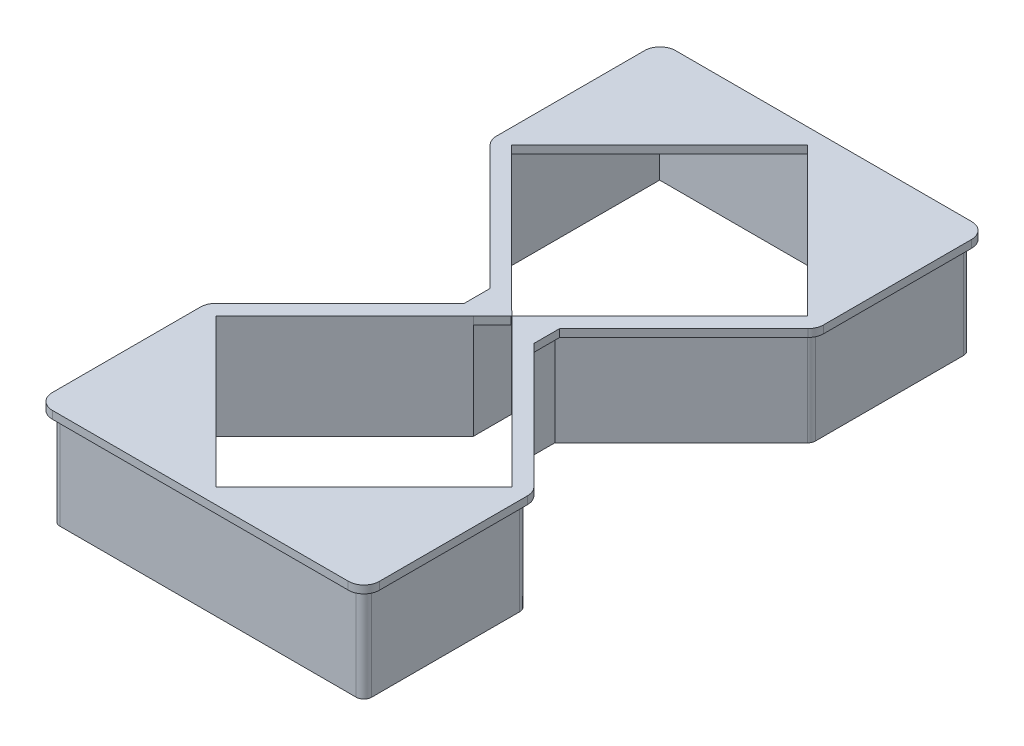
from build123d import *

# Parameters (mm, degrees)
EXTRUDE_2_DEPTH      = 1.2
EXTRUDE_4_DEPTH      = 15
CUT_EXTRUDE_13_REACH = 109.14
CUT_EXTRUDE_15_REACH = 109.14
CUT_EXTRUDE_16_REACH = 109.14
CUT_EXTRUDE_17_REACH = 73.673


with BuildPart() as part:
    # 草图1 → 凸台-拉伸2 (new body)
    with BuildSketch(Plane(origin=(0, 0, 0), x_dir=(1, 0, 0), z_dir=(0, 1, 0))):
        with BuildLine():
            Line((-2.399264051, 68.999900529), (-2.399264051, 91.999900529))
            ThreePointArc((-2.399264051, 91.999900529), (-1.696320326, 93.696956804), (0.000735949, 94.399900529))
            Line((0.000735949, 94.399900529), (46.000735949, 94.399900529))
            ThreePointArc((46.000735949, 94.399900529), (47.697792224, 93.696956804), (48.400735949, 91.999900529))
            Line((48.400735949, 91.999900529), (48.400735949, 68.999900529))
            ThreePointArc((48.400735949, 68.999900529), (48.218046827, 68.081460292), (47.697792224, 67.302844254))
            Line((47.697792224, 67.302844254), (28.40092775, 48.00597978))
            Line((28.40092775, 48.00597978), (28.40092775, 43.99420488))
            Line((28.40092775, 43.99420488), (47.697792224, 24.697340406))
            ThreePointArc((47.697792224, 24.697340406), (48.218046827, 23.918724369), (48.400735949, 23.000284131))
            Line((48.400735949, 23.000284131), (48.400735949, 0.000284131))
            ThreePointArc((48.400735949, 0.000284131), (47.681245751, -1.713158837), (45.954163612, -2.399263955))
            Line((45.954163612, -2.399263955), (0.000735672, -2.399263955))
            ThreePointArc((0.000735672, -2.399263955), (-1.696376241, -1.696695528), (-2.399264051, 0.000284131))
            Line((-2.399264051, 0.000284131), (-2.399264051, 23.000284131))
            ThreePointArc((-2.399264051, 23.000284131), (-2.216574929, 23.918724369), (-1.696320326, 24.697340406))
            Line((-1.696320326, 24.697340406), (17.600544148, 43.99420488))
            Line((17.600544148, 43.99420488), (17.600544148, 48.00597978))
            Line((17.600544148, 48.00597978), (-1.696320326, 67.302844254))
            ThreePointArc((-1.696320326, 67.302844254), (-2.216574929, 68.081460292), (-2.399264051, 68.999900529))
        make_face()
    extrude(amount=EXTRUDE_2_DEPTH)

    # 草图3 → 凸台-拉伸4 (add)
    with BuildSketch(Plane.XZ):
        with BuildLine():
            Line((0, -93.138725211), (46, -93.138725211))
            ThreePointArc((46, -93.138725211), (46.848528137, -92.787253348), (47.2, -91.938725211))
            Line((47.2, -91.938725211), (47.2, -68.938725211))
            ThreePointArc((47.2, -68.938725211), (47.108655439, -68.479505092), (46.848528137, -68.090197073))
            Line((46.848528137, -68.090197073), (27.200191801, -48.441860737))
            Line((27.200191801, -48.441860737), (27.200191801, -43.496864474))
            Line((27.200191801, -43.496864474), (46.848528137, -23.848528137))
            ThreePointArc((46.848528137, -23.848528137), (47.108655439, -23.459220119), (47.2, -23))
            Line((47.2, -23), (47.2, 0))
            ThreePointArc((47.2, 0), (46.848528137, 0.848528137), (46, 1.2))
            Line((46, 1.2), (0, 1.2))
            ThreePointArc((0, 1.2), (-0.848528137, 0.848528137), (-1.2, 0))
            Line((-1.2, 0), (-1.2, -23))
            ThreePointArc((-1.2, -23), (-1.108655439, -23.459220119), (-0.848528137, -23.848528137))
            Line((-0.848528137, -23.848528137), (18.799808199, -43.496864474))
            Line((18.799808199, -43.496864474), (18.799808199, -48.441860737))
            Line((18.799808199, -48.441860737), (-0.848528137, -68.090197073))
            ThreePointArc((-0.848528137, -68.090197073), (-1.108655439, -68.479505092), (-1.2, -68.938725211))
            Line((-1.2, -68.938725211), (-1.2, -91.938725211))
            ThreePointArc((-1.2, -91.938725211), (-0.848528137, -92.787253348), (0, -93.138725211))
        make_face()
        Polygon((0, -23), (19.999808199, -42.999808199), (19.999808199, -48.938917012), (0, -68.938725211), (0, -91.938725211), (46, -91.938725211), (46, -68.938725211), (26.000191801, -48.999808199), (26.000191801, -42.999808199), (46, -23), (46, 0), (0, 0), align=None, mode=Mode.SUBTRACT)
    extrude(amount=EXTRUDE_4_DEPTH)

    # 草图11 → 切除-拉伸13 (cut, up to next)
    with BuildSketch(Plane(origin=(0, 0, 0), x_dir=(-1, 0, 0), z_dir=(0, -1, 0)), mode=Mode.PRIVATE) as cut_extrude_13_sk1:
        Polygon((-19.999808199, 42.999808199), (-23, 45.969362605), (-26.000191801, 42.999808199), (-46, 23), (-23, 0), (0, 23), align=None)
    cut_extrude_13_tool1 = extrude(cut_extrude_13_sk1.sketch, amount=-CUT_EXTRUDE_13_REACH, mode=Mode.PRIVATE) & part.part
    add(cut_extrude_13_tool1.solids().sort_by_distance((23, 0, -22.998089))[0], mode=Mode.SUBTRACT)

    # 草图16 → 切除-拉伸15 (cut, up to next)
    with BuildSketch(Plane.XZ, mode=Mode.PRIVATE) as cut_extrude_15_sk1:
        Polygon((0, -68.938725211), (23, -91.938725211), (46, -68.938725211), (26.000191801, -48.999808199), (23.071072637, -46.041151936), (23.071072637, -45.899015749), (22.928927363, -45.899015749), (22.928927363, -46.039709462), (19.999808199, -48.938917012), align=None)
    cut_extrude_15_tool1 = extrude(cut_extrude_15_sk1.sketch, amount=-CUT_EXTRUDE_15_REACH, mode=Mode.PRIVATE) & part.part
    add(cut_extrude_15_tool1.solids().sort_by_distance((22.99426, 0, -68.949789))[0], mode=Mode.SUBTRACT)

    # 草图17 → 切除-拉伸16 (cut, up to next)
    with BuildSketch(Plane(origin=(0, 0, 0), x_dir=(0, 0, -1), z_dir=(1, 0, 0)), mode=Mode.PRIVATE) as cut_extrude_16_sk1:
        Polygon((10, -11), (10, -15), (15, -15), (20, -15), (20, -11), (15, -11), align=None)
    cut_extrude_16_tool1 = extrude(cut_extrude_16_sk1.sketch, amount=-CUT_EXTRUDE_16_REACH, mode=Mode.PRIVATE) & part.part
    add(cut_extrude_16_tool1.solids().sort_by_distance((0, -13, -15))[0], mode=Mode.SUBTRACT)

    # 草图18 → 切除-拉伸17 (cut, up to next)
    with BuildSketch(Plane(origin=(35.348528137, 0, -35.348528137), x_dir=(-0.707106781186532, 0, -0.707106781186563), z_dir=(0.707106781186563, 0, -0.707106781186532)), mode=Mode.PRIVATE) as cut_extrude_17_sk1:
        Polygon((-2.369984105, -15), (5.130015895, -15), (5.130015895, -5), (-9.869984105, -5), (-9.869984105, -15), align=None)
    cut_extrude_17_tool1 = extrude(cut_extrude_17_sk1.sketch, amount=-CUT_EXTRUDE_17_REACH, mode=Mode.PRIVATE) & part.part
    add(cut_extrude_17_tool1.solids().sort_by_distance((37.02436, -10, -33.672696))[0], mode=Mode.SUBTRACT)


solid = part.part
